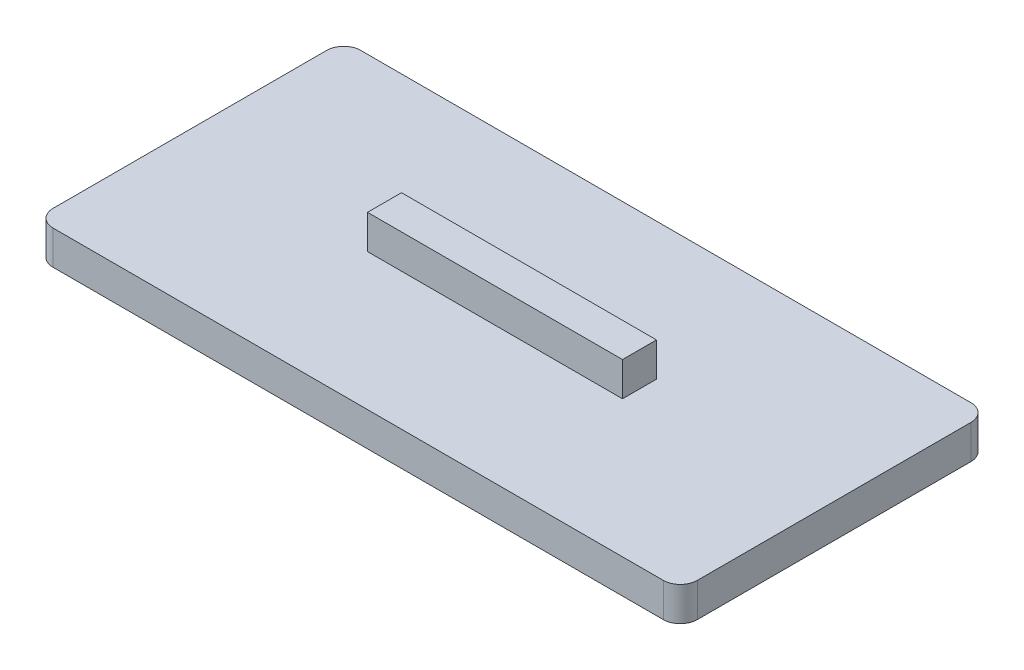
from build123d import *

# Parameters (mm, degrees)
BOSS_EXTRUDE1_DEPTH = 2.54
SKETCH2_W           = 19.05
SKETCH2_H           = 2.54
BOSS_EXTRUDE2_DEPTH = 1.27


with BuildPart() as part:
    # Sketch1 → Boss-Extrude1 (new body)
    with BuildSketch(Plane(origin=(0, 0, 0), x_dir=(1, 0, 0), z_dir=(0, 1, 0))):
        with BuildLine():
            Line((-22.7965, -11.4935), (22.7965, -11.4935))
            ThreePointArc((22.7965, -11.4935), (23.694525612, -11.121525612), (24.0665, -10.2235))
            Line((24.0665, -10.2235), (24.0665, 10.2235))
            ThreePointArc((24.0665, 10.2235), (23.694525612, 11.121525612), (22.7965, 11.4935))
            Line((22.7965, 11.4935), (-22.7965, 11.4935))
            ThreePointArc((-22.7965, 11.4935), (-23.694525612, 11.121525612), (-24.0665, 10.2235))
            Line((-24.0665, 10.2235), (-24.0665, -10.2235))
            ThreePointArc((-24.0665, -10.2235), (-23.694525612, -11.121525612), (-22.7965, -11.4935))
        make_face()
    extrude(amount=-BOSS_EXTRUDE1_DEPTH)

    # Sketch2 → Boss-Extrude2 (add, symmetric)
    with BuildSketch(Plane.XY):
        with Locations((0, 1.27)):
            Rectangle(SKETCH2_W, SKETCH2_H)
    extrude(amount=BOSS_EXTRUDE2_DEPTH, both=True)


solid = part.part
